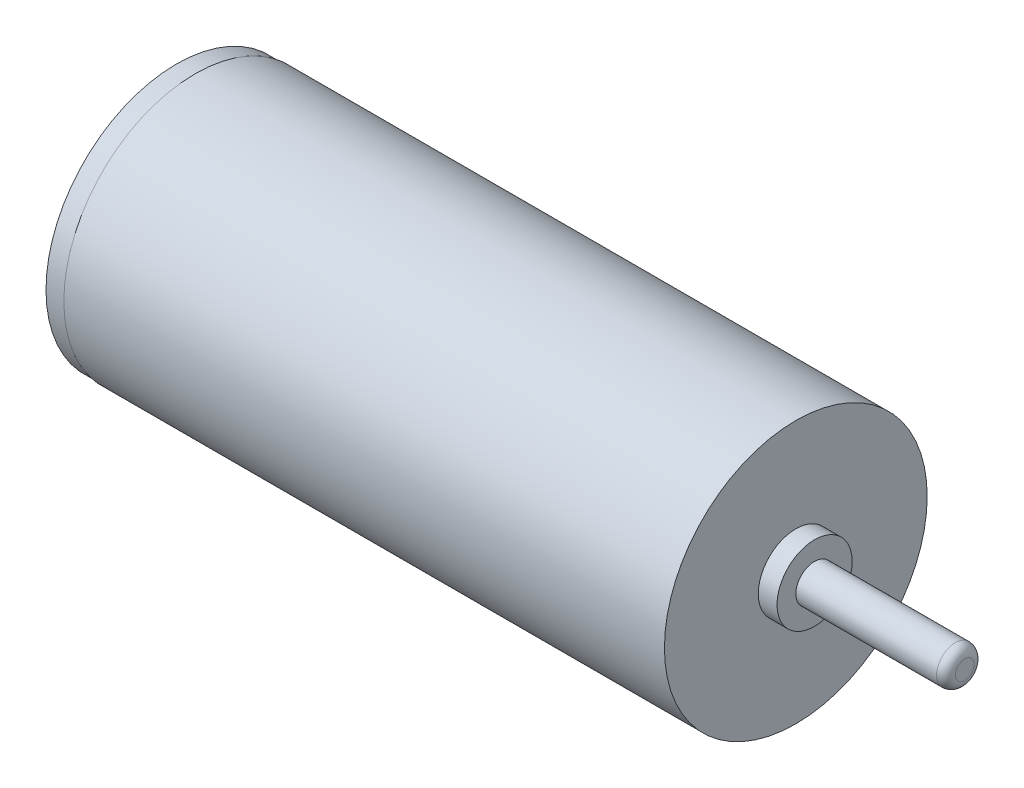
from build123d import *

# Parameters (mm, degrees)
SKETCH1_R           = 3.5
BOSS_EXTRUDE1_DEPTH = 16
SKETCH2_R           = 1
BOSS_EXTRUDE2_DEPTH = 0.5
SKETCH3_R           = 0.5
BOSS_EXTRUDE3_DEPTH = 4
FILLET1_R           = 0.25
SKETCH7_R           = 3.475
BOSS_EXTRUDE6_DEPTH = 0.5
BOSS_EXTRUDE7_START = 1
SKETCH8_R           = 1
BOSS_EXTRUDE7_DEPTH = 1


with BuildPart() as part:
    # Sketch1 → Boss-Extrude1 (new body)
    with BuildSketch(Plane(origin=(0, 0, 0), x_dir=(0, 0, -1), z_dir=(1, 0, 0))):
        Circle(SKETCH1_R)
    extrude(amount=-BOSS_EXTRUDE1_DEPTH)

    # Sketch2 → Boss-Extrude2 (add)
    with BuildSketch(Plane(origin=(0, 0, 0), x_dir=(0, 0, -1), z_dir=(1, 0, 0))):
        Circle(SKETCH2_R)
    extrude(amount=BOSS_EXTRUDE2_DEPTH)

    # Sketch3 → Boss-Extrude3 (add)
    with BuildSketch(Plane(origin=(0.5, 0, 0), x_dir=(0, 0, -1), z_dir=(1, 0, 0))):
        Circle(SKETCH3_R)
    extrude(amount=BOSS_EXTRUDE3_DEPTH)

    # Fillet1
    fillet1_edges = [part.edges().sort_by_distance(p)[0] for p in [
        (4.5, 0, 0.5),
    ]]
    fillet(fillet1_edges, radius=FILLET1_R)

    # Sketch7 → Boss-Extrude6 (add)
    with BuildSketch(Plane.ZY.offset(16)):
        with Locations(Location((0, 0, 0), (0, 0, 180))):
            Circle(SKETCH7_R)
    extrude(amount=BOSS_EXTRUDE6_DEPTH)

    # Sketch8 → Boss-Extrude7 (add)
    with BuildSketch(Plane.ZY.offset(16.5).offset(BOSS_EXTRUDE7_START)):
        with Locations(Location((0, 0, 0), (0, 0, 180))):
            Circle(SKETCH8_R)
    extrude(amount=-BOSS_EXTRUDE7_DEPTH)


solid = part.part
